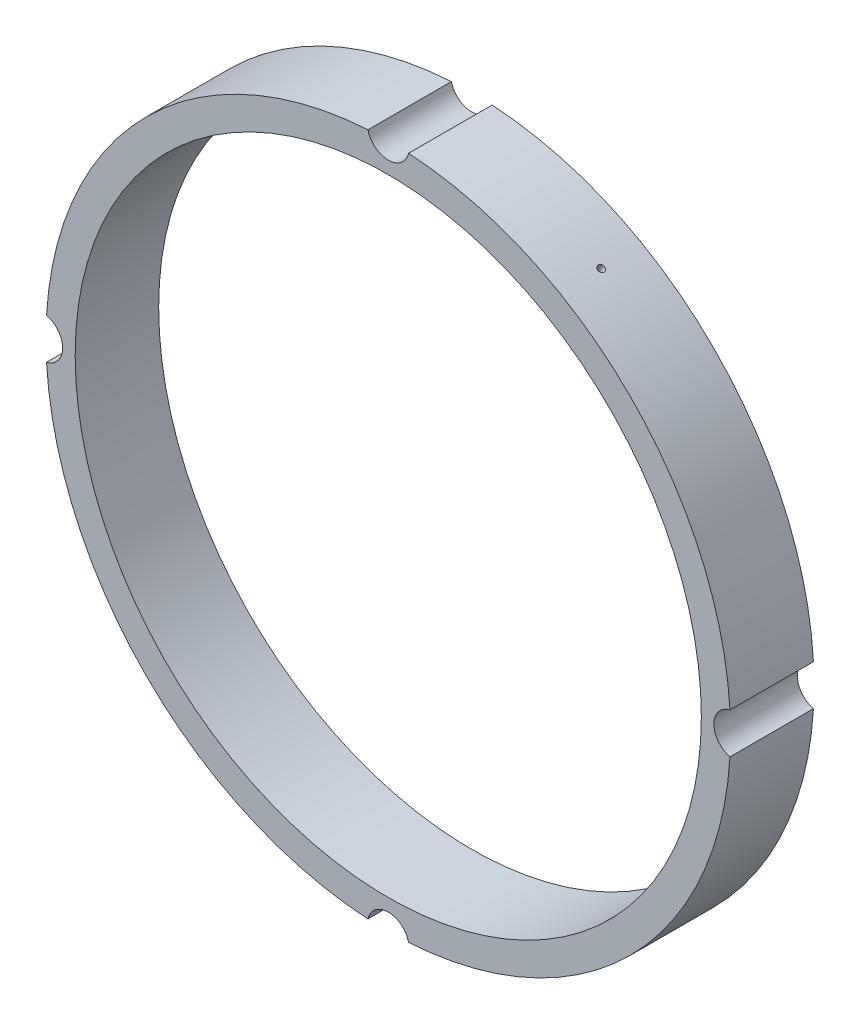
from build123d import *

# Parameters (mm, degrees)
SKETCH1_R                 = 82
SKETCH1_R_2               = 75
BOSS_EXTRUDE1_DEPTH       = 20
SKETCH2_R                 = 5
CUT_EXTRUDE1_DEPTH        = 118.677525467
CIRPATTERN1_COUNT         = 4
M2X0_4_TAPPED_HOLE1_D     = 1.6
M2X0_4_TAPPED_HOLE1_DEPTH = 10
M2X0_4_TAPPED_HOLE1_TIP   = 0.480688495


with BuildPart() as part:
    # Sketch1 → Boss-Extrude1 (new body)
    with BuildSketch(Plane.XY):
        Circle(SKETCH1_R)
        Circle(SKETCH1_R_2, mode=Mode.SUBTRACT)
    extrude(amount=BOSS_EXTRUDE1_DEPTH)

    # Sketch2 → Cut-Extrude1 (cut, through all)
    with BuildSketch(Plane.XY.offset(20)):
        with Locations((0, 83)):
            Circle(SKETCH2_R)
    cut_extrude1 = extrude(amount=-CUT_EXTRUDE1_DEPTH, mode=Mode.SUBTRACT)

    # CirPattern1: Cut-Extrude1 ×4 about axis
    cirpattern1_axis = Axis((0, 0, 0), (0, 0, 1))
    for i in range(1, CIRPATTERN1_COUNT):
        add(cut_extrude1.rotate(cirpattern1_axis, i * 360 / CIRPATTERN1_COUNT), mode=Mode.SUBTRACT)

    # M2x0.4 Tapped Hole1
    with Locations(Plane(origin=(41, 71.01408311, 10), x_dir=(0.866025403784, -0.5, 0), z_dir=(0.5, 0.866025403784, 0))):
        with Locations((0, 0)):
            Hole(M2X0_4_TAPPED_HOLE1_D / 2, depth=M2X0_4_TAPPED_HOLE1_DEPTH)
            with Locations((0, 0, -(M2X0_4_TAPPED_HOLE1_DEPTH + M2X0_4_TAPPED_HOLE1_TIP / 2))):  # 118° drill point
                Cone(0, M2X0_4_TAPPED_HOLE1_D / 2, M2X0_4_TAPPED_HOLE1_TIP, mode=Mode.SUBTRACT)


solid = part.part
